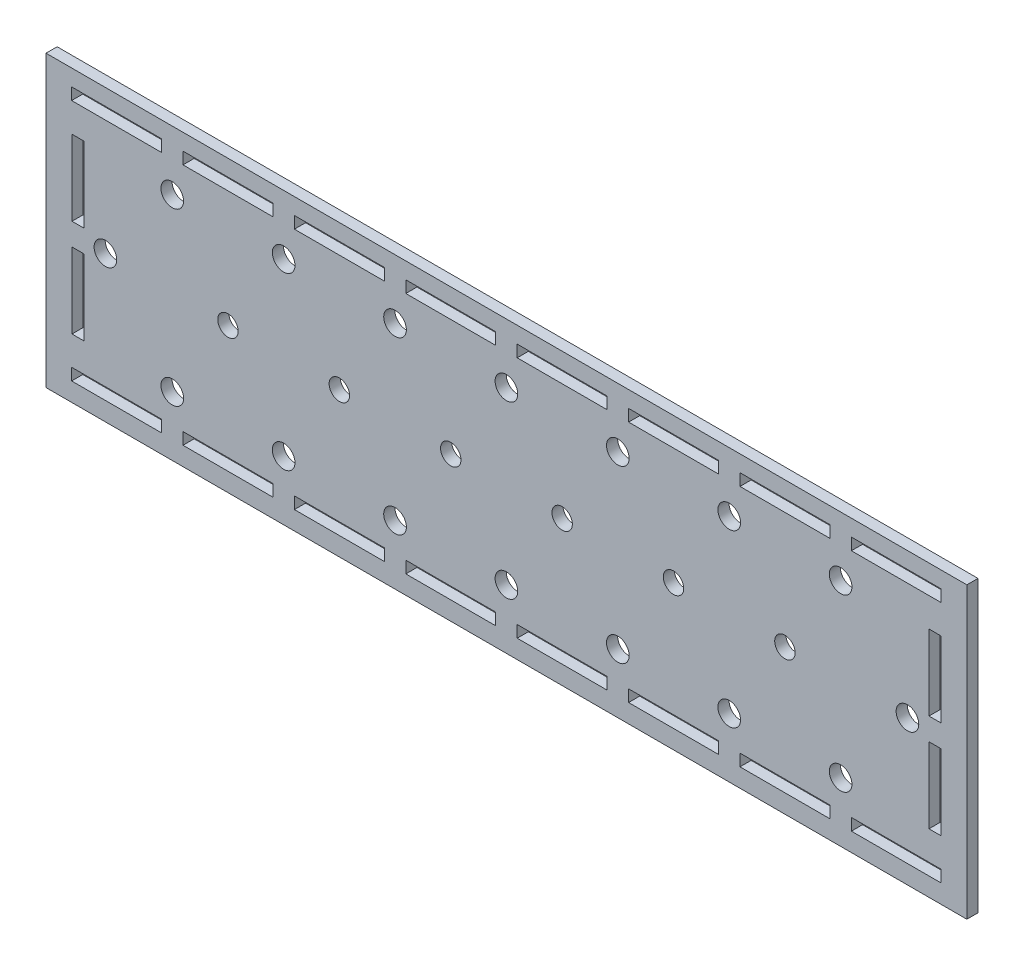
from build123d import *

# Parameters (mm, degrees)
SKETCH1_W           = 248
SKETCH1_H           = 78
SKETCH1_R           = 3.05
SKETCH1_W_2         = 24.2
SKETCH1_H_2         = 3.2
SKETCH1_W_3         = 3.2
SKETCH1_H_3         = 20.3
BOSS_EXTRUDE2_DEPTH = 3
SKETCH5_R           = 2.75
CUT_EXTRUDE1_DEPTH  = 10


with BuildPart() as part:
    # Sketch1 → Boss-Extrude2 (new body)
    with BuildSketch(Plane(origin=(0, 0, 0), x_dir=(-1, 0, 0), z_dir=(0, 0, 1))):
        with Locations((-428.787224347, 459)):
            Rectangle(SKETCH1_W, SKETCH1_H)
        with Locations(Location((-338.787224347, 436, 0), (0, 0, 180))):
            Circle(SKETCH1_R, mode=Mode.SUBTRACT)
        with Locations(Location((-368.787224347, 436, 0), (0, 0, 180))):
            Circle(SKETCH1_R, mode=Mode.SUBTRACT)
        with Locations(Location((-428.787224347, 436, 0), (0, 0, 180))):
            Circle(SKETCH1_R, mode=Mode.SUBTRACT)
        with Locations(Location((-398.787224347, 436, 0), (0, 0, 180))):
            Circle(SKETCH1_R, mode=Mode.SUBTRACT)
        with Locations(Location((-488.787224347, 436, 0), (0, 0, 180))):
            Circle(SKETCH1_R, mode=Mode.SUBTRACT)
        with Locations(Location((-458.787224347, 436, 0), (0, 0, 180))):
            Circle(SKETCH1_R, mode=Mode.SUBTRACT)
        with Locations(Location((-458.787224347, 482, 0), (0, 0, 180))):
            Circle(SKETCH1_R, mode=Mode.SUBTRACT)
        with Locations(Location((-428.787224347, 482, 0), (0, 0, 180))):
            Circle(SKETCH1_R, mode=Mode.SUBTRACT)
        with Locations(Location((-398.787224347, 482, 0), (0, 0, 180))):
            Circle(SKETCH1_R, mode=Mode.SUBTRACT)
        with Locations(Location((-368.787224347, 482, 0), (0, 0, 180))):
            Circle(SKETCH1_R, mode=Mode.SUBTRACT)
        with Locations(Location((-338.787224347, 482, 0), (0, 0, 180))):
            Circle(SKETCH1_R, mode=Mode.SUBTRACT)
        with Locations(Location((-320.787224347, 458.7, 0), (0, 0, 180))):
            Circle(SKETCH1_R, mode=Mode.SUBTRACT)
        with Locations(Location((-488.787224347, 482, 0), (0, 0, 180))):
            Circle(SKETCH1_R, mode=Mode.SUBTRACT)
        with Locations(Location((-518.787224347, 436, 0), (0, 0, 180))):
            Circle(SKETCH1_R, mode=Mode.SUBTRACT)
        with Locations(Location((-536.787224347, 459, 0), (0, 0, 180))):
            Circle(SKETCH1_R, mode=Mode.SUBTRACT)
        with Locations(Location((-518.787224347, 482, 0), (0, 0, 180))):
            Circle(SKETCH1_R, mode=Mode.SUBTRACT)
        with Locations((-383.787224347, 491.4)):
            Rectangle(SKETCH1_W_2, SKETCH1_H_2, mode=Mode.SUBTRACT)
        with Locations((-413.787224347, 491.4)):
            Rectangle(SKETCH1_W_2, SKETCH1_H_2, mode=Mode.SUBTRACT)
        with Locations((-353.787224347, 491.4)):
            Rectangle(SKETCH1_W_2, SKETCH1_H_2, mode=Mode.SUBTRACT)
        with Locations((-443.787224347, 491.4)):
            Rectangle(SKETCH1_W_2, SKETCH1_H_2, mode=Mode.SUBTRACT)
        with Locations((-473.787224347, 491.4)):
            Rectangle(SKETCH1_W_2, SKETCH1_H_2, mode=Mode.SUBTRACT)
        with Locations((-503.787224347, 491.4)):
            Rectangle(SKETCH1_W_2, SKETCH1_H_2, mode=Mode.SUBTRACT)
        with Locations((-533.787224347, 491.4)):
            Rectangle(SKETCH1_W_2, SKETCH1_H_2, mode=Mode.SUBTRACT)
        with Locations((-323.787224347, 491.4)):
            Rectangle(SKETCH1_W_2, SKETCH1_H_2, mode=Mode.SUBTRACT)
        with Locations((-313.387224347, 445.55)):
            Rectangle(SKETCH1_W_3, SKETCH1_H_3, mode=Mode.SUBTRACT)
        with Locations((-313.387224347, 471.85)):
            Rectangle(SKETCH1_W_3, SKETCH1_H_3, mode=Mode.SUBTRACT)
        with Locations((-544.187224347, 445.55)):
            Rectangle(SKETCH1_W_3, SKETCH1_H_3, mode=Mode.SUBTRACT)
        with Locations((-544.187224347, 471.85)):
            Rectangle(SKETCH1_W_3, SKETCH1_H_3, mode=Mode.SUBTRACT)
        with Locations((-533.787224347, 426)):
            Rectangle(SKETCH1_W_2, SKETCH1_H_2, mode=Mode.SUBTRACT)
        with Locations((-503.787224347, 426)):
            Rectangle(SKETCH1_W_2, SKETCH1_H_2, mode=Mode.SUBTRACT)
        with Locations((-473.787224347, 426)):
            Rectangle(SKETCH1_W_2, SKETCH1_H_2, mode=Mode.SUBTRACT)
        with Locations((-443.787224347, 426)):
            Rectangle(SKETCH1_W_2, SKETCH1_H_2, mode=Mode.SUBTRACT)
        with Locations((-413.787224347, 426)):
            Rectangle(SKETCH1_W_2, SKETCH1_H_2, mode=Mode.SUBTRACT)
        with Locations((-383.787224347, 426)):
            Rectangle(SKETCH1_W_2, SKETCH1_H_2, mode=Mode.SUBTRACT)
        with Locations((-353.787224347, 426)):
            Rectangle(SKETCH1_W_2, SKETCH1_H_2, mode=Mode.SUBTRACT)
        with Locations((-323.787224347, 426)):
            Rectangle(SKETCH1_W_2, SKETCH1_H_2, mode=Mode.SUBTRACT)
    extrude(amount=BOSS_EXTRUDE2_DEPTH)

    # Sketch5 → Cut-Extrude1 (cut)
    with BuildSketch(Plane.XY.offset(3)):
        with Locations((353.787224347, -459)):
            Circle(SKETCH5_R)
        with Locations((383.787224347, -459)):
            Circle(SKETCH5_R)
        with Locations((413.787224347, -459)):
            Circle(SKETCH5_R)
        with Locations((443.787224347, -459)):
            Circle(SKETCH5_R)
        with Locations((473.787224347, -459)):
            Circle(SKETCH5_R)
        with Locations((503.787224347, -459)):
            Circle(SKETCH5_R)
    extrude(amount=-CUT_EXTRUDE1_DEPTH, mode=Mode.SUBTRACT)


solid = part.part
